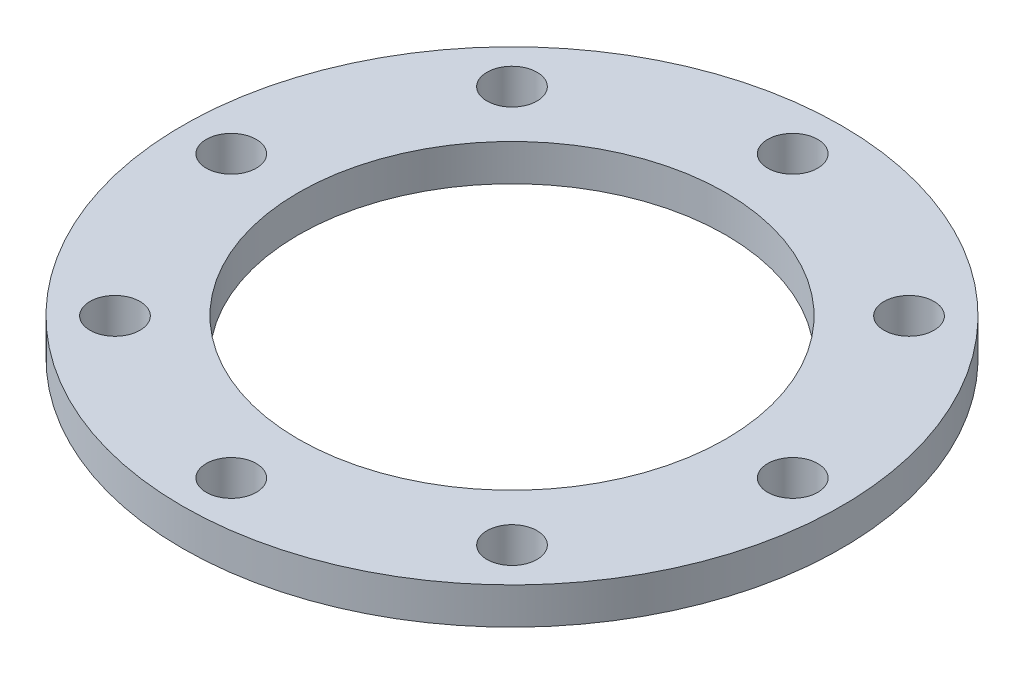
from build123d import *

# Parameters (mm, degrees)
SKETCH1_R           = 27
SKETCH1_R_2         = 17.5
BOSS_EXTRUDE1_DEPTH = 3
SKETCH2_R           = 2.05
CUT_EXTRUDE1_DEPTH  = 39.301436004
CIRPATTERN1_COUNT   = 8


with BuildPart() as part:
    # Sketch1 → Boss-Extrude1 (new body)
    with BuildSketch(Plane(origin=(0, 0, 0), x_dir=(1, 0, 0), z_dir=(0, 1, 0))):
        with Locations(Location((0, 0, 0), (0, 0, 270))):
            Circle(SKETCH1_R)
        with Locations(Location((0, 0, 0), (0, 0, 270))):
            Circle(SKETCH1_R_2, mode=Mode.SUBTRACT)
    extrude(amount=BOSS_EXTRUDE1_DEPTH)

    # Sketch2 → Cut-Extrude1 (cut, through all)
    with BuildSketch(Plane(origin=(0, 3, 0), x_dir=(1, 0, 0), z_dir=(0, 1, 0))):
        with Locations(Location((23, 0, 0), (0, 0, 270))):
            Circle(SKETCH2_R)
    cut_extrude1 = extrude(amount=-CUT_EXTRUDE1_DEPTH, mode=Mode.SUBTRACT)

    # CirPattern1: Cut-Extrude1 ×8 about axis
    cirpattern1_axis = Axis((0, 0, 0), (0, 1, 0))
    for i in range(1, CIRPATTERN1_COUNT):
        add(cut_extrude1.rotate(cirpattern1_axis, i * 360 / CIRPATTERN1_COUNT), mode=Mode.SUBTRACT)


solid = part.part
